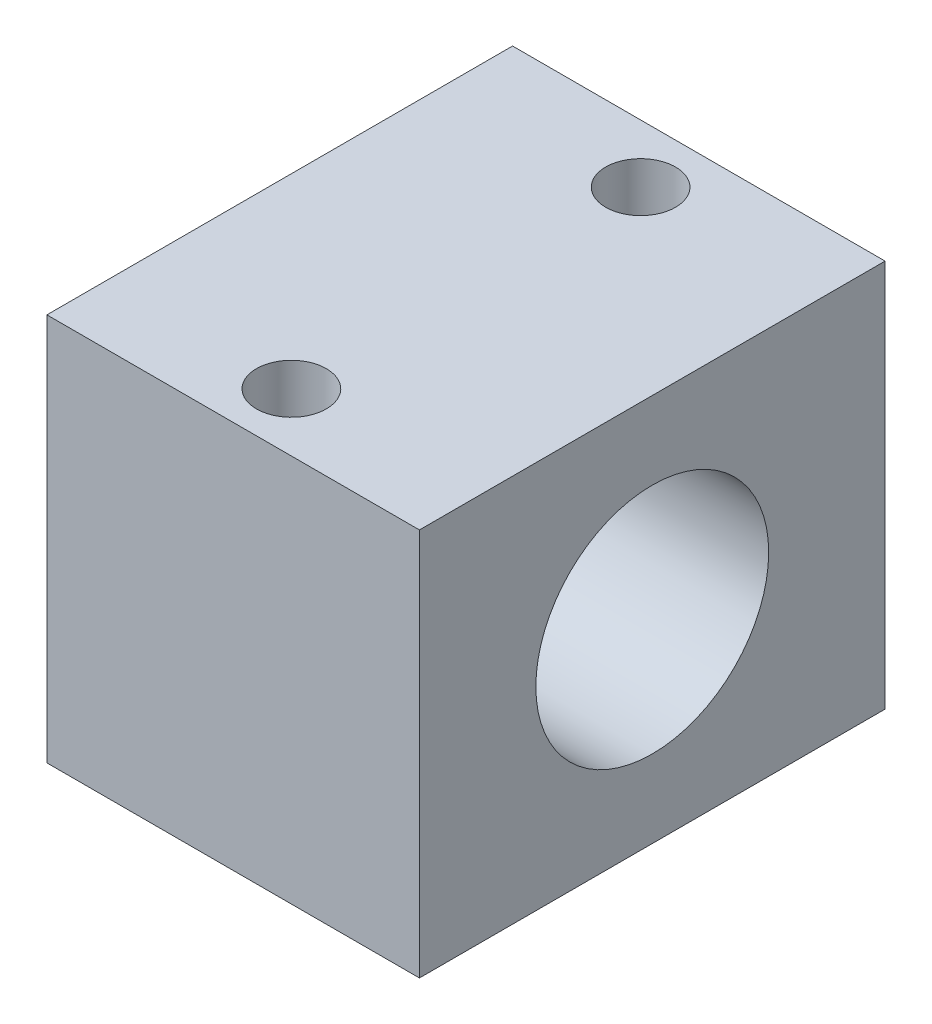
from build123d import *

# Parameters (mm, degrees)
CROQUIS1_W              = 30
CROQUIS1_H              = 25
SALIENTE_EXTRUIR1_DEPTH = 24
CROQUIS2_R              = 7.5
CORTAR_EXTRUIR1_DEPTH   = 24
CORTAR_EXTRUIR4_REACH   = 41.639
CROQUIS4_R              = 2.25


with BuildPart() as part:
    # Croquis1 → Saliente-Extruir1 (new body)
    with BuildSketch(Plane(origin=(0, 0, 0), x_dir=(0, 0, -1), z_dir=(1, 0, 0))):
        with Locations((4.241023359, 4.022714127)):
            Rectangle(CROQUIS1_W, CROQUIS1_H)
    extrude(amount=SALIENTE_EXTRUIR1_DEPTH)

    # Croquis2 → Cortar-Extruir1 (cut)
    with BuildSketch(Plane.ZY):
        with Locations((-4.241023359, 4.022714127)):
            Circle(CROQUIS2_R)
    extrude(amount=-CORTAR_EXTRUIR1_DEPTH, mode=Mode.SUBTRACT)

    # Croquis4 → Cortar-Extruir4 (cut, up to next)
    with BuildSketch(Plane(origin=(0, 16.522714127, 0), x_dir=(1, 0, 0), z_dir=(0, 1, 0)), mode=Mode.PRIVATE) as cortar_extruir4_sk1:
        with Locations(Location((12, 15.491023359, 0), (0, 0, 270))):
            Circle(CROQUIS4_R)
    cortar_extruir4_tool1 = extrude(cortar_extruir4_sk1.sketch, amount=-CORTAR_EXTRUIR4_REACH, mode=Mode.PRIVATE) & part.part
    # Croquis4 → Cortar-Extruir4 (cut, up to next)
    with BuildSketch(Plane(origin=(0, 16.522714127, 0), x_dir=(1, 0, 0), z_dir=(0, 1, 0)), mode=Mode.PRIVATE) as cortar_extruir4_sk2:
        with Locations(Location((12, -7.008976641, 0), (0, 0, 270))):
            Circle(CROQUIS4_R)
    cortar_extruir4_tool2 = extrude(cortar_extruir4_sk2.sketch, amount=-CORTAR_EXTRUIR4_REACH, mode=Mode.PRIVATE) & part.part
    add(cortar_extruir4_tool1.solids().sort_by_distance((12, 16.522714, -15.491023))[0], mode=Mode.SUBTRACT)
    add(cortar_extruir4_tool2.solids().sort_by_distance((12, 16.522714, 7.008977))[0], mode=Mode.SUBTRACT)


solid = part.part
